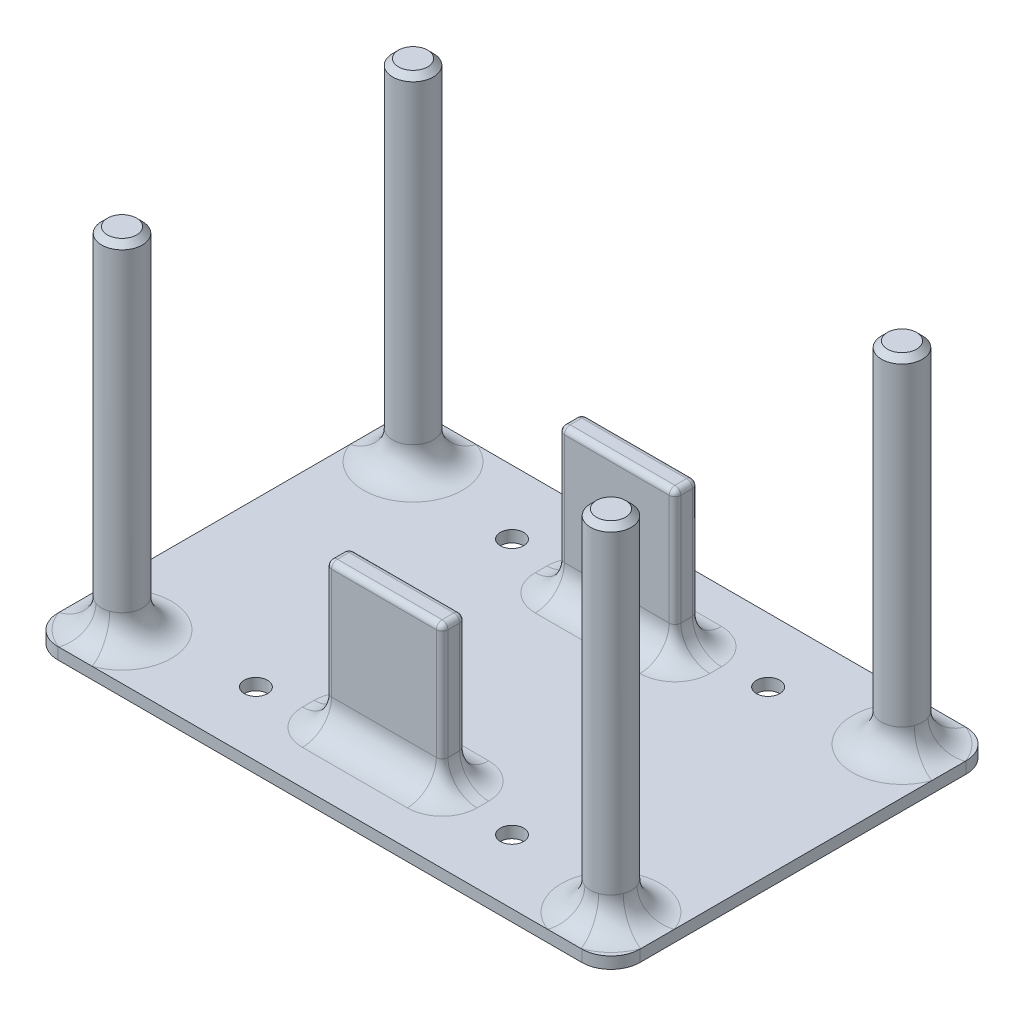
from build123d import *

# Parameters (mm, degrees)
BOSS_EXTRUDE1_DEPTH = 2
SKETCH3_R           = 3.5
BOSS_EXTRUDE2_DEPTH = 60
BOSS_EXTRUDE3_DEPTH = 25
FILLET3_R           = 5
SKETCH6_R           = 2
CUT_EXTRUDE1_DEPTH  = 101.441876541
FILLET4_R           = 5
FILLET5_R           = 1
CHAMFER1_SIZE       = 1


with BuildPart() as part:
    # Sketch1 → Boss-Extrude1 (new body)
    with BuildSketch(Plane(origin=(0, 0, 0), x_dir=(1, 0, 0), z_dir=(0, 1, 0))):
        with BuildLine():
            Line((-35.932773109, 54.768907563), (54.067226891, 54.768907563))
            ThreePointArc((54.067226891, 54.768907563), (57.602760797, 53.304441469), (59.067226891, 49.768907563))
            Line((59.067226891, 49.768907563), (59.067226891, -6.231092437))
            ThreePointArc((59.067226891, -6.231092437), (57.602760797, -9.766626343), (54.067226891, -11.231092437))
            Line((54.067226891, -11.231092437), (-35.932773109, -11.231092437))
            ThreePointArc((-35.932773109, -11.231092437), (-39.468307015, -9.766626343), (-40.932773109, -6.231092437))
            Line((-40.932773109, -6.231092437), (-40.932773109, 49.768907563))
            ThreePointArc((-40.932773109, 49.768907563), (-39.468307015, 53.304441469), (-35.932773109, 54.768907563))
        make_face()
    extrude(amount=BOSS_EXTRUDE1_DEPTH)

    # Sketch3 → Boss-Extrude2 (add)
    with BuildSketch(Plane(origin=(0, 2, 0), x_dir=(1, 0, 0), z_dir=(0, 1, 0))):
        with Locations(Location((-32.932773109, 46.768907563, 0), (0, 0, 270))):
            Circle(SKETCH3_R)
        with Locations(Location((-32.932773109, -3.231092437, 0), (0, 0, 270))):
            Circle(SKETCH3_R)
        with Locations(Location((51.067226891, -3.231092437, 0), (0, 0, 90))):
            Circle(SKETCH3_R)
        with Locations(Location((51.067226891, 46.768907563, 0), (0, 0, 270))):
            Circle(SKETCH3_R)
    extrude(amount=BOSS_EXTRUDE2_DEPTH)

    # Sketch4 → Boss-Extrude3 (add)
    with BuildSketch(Plane(origin=(0, 2, 0), x_dir=(1, 0, 0), z_dir=(0, 1, 0))):
        with BuildLine():
            Line((0.067226891, 43.768907563), (18.067226891, 43.768907563))
            ThreePointArc((18.067226891, 43.768907563), (18.774333672, 43.476014344), (19.067226891, 42.768907563))
            Line((19.067226891, 42.768907563), (19.067226891, 40.768907563))
            ThreePointArc((19.067226891, 40.768907563), (18.774333672, 40.061800782), (18.067226891, 39.768907563))
            Line((18.067226891, 39.768907563), (0.067226891, 39.768907563))
            ThreePointArc((0.067226891, 39.768907563), (-0.63987989, 40.061800782), (-0.932773109, 40.768907563))
            Line((-0.932773109, 40.768907563), (-0.932773109, 42.768907563))
            ThreePointArc((-0.932773109, 42.768907563), (-0.63987989, 43.476014344), (0.067226891, 43.768907563))
        make_face()
        with BuildLine():
            Line((19.067226891, 0.768907563), (19.067226891, 2.768907563))
            ThreePointArc((19.067226891, 2.768907563), (18.774333672, 3.476014344), (18.067226891, 3.768907563))
            Line((18.067226891, 3.768907563), (0.067226891, 3.768907563))
            ThreePointArc((0.067226891, 3.768907563), (-0.63987989, 3.476014344), (-0.932773109, 2.768907563))
            Line((-0.932773109, 2.768907563), (-0.932773109, 0.768907563))
            ThreePointArc((-0.932773109, 0.768907563), (-0.63987989, 0.061800782), (0.067226891, -0.231092437))
            Line((0.067226891, -0.231092437), (18.067226891, -0.231092437))
            ThreePointArc((18.067226891, -0.231092437), (18.774333672, 0.061800782), (19.067226891, 0.768907563))
        make_face()
    extrude(amount=BOSS_EXTRUDE3_DEPTH)

    # Fillet3
    fillet3_edges = [part.edges().sort_by_distance(p)[0] for p in [
        (-32.932773109, 2, -50.268907563),
        (-32.932773109, 2, -0.268907563),
        (51.067226891, 2, 6.731092437),
        (51.067226891, 2, -50.268907563),
    ]]
    fillet(fillet3_edges, radius=FILLET3_R)

    # Sketch6 → Cut-Extrude1 (cut, through all)
    with BuildSketch(Plane(origin=(0, 2, 0), x_dir=(1, 0, 0), z_dir=(0, 1, 0))):
        with Locations(Location((-12.932773109, 43.768907563, 0), (0, 0, 270))):
            Circle(SKETCH6_R)
        with Locations(Location((-12.932773109, -0.231092437, 0), (0, 0, 270))):
            Circle(SKETCH6_R)
        with Locations(Location((31.067226891, -0.231092437, 0), (0, 0, 90))):
            Circle(SKETCH6_R)
        with Locations(Location((31.067226891, 43.768907563, 0), (0, 0, 90))):
            Circle(SKETCH6_R)
    extrude(amount=-CUT_EXTRUDE1_DEPTH, mode=Mode.SUBTRACT)

    # Fillet4
    fillet4_edges = [part.edges().sort_by_distance(p)[0] for p in [
        (-0.63987989, 2, -0.061800782),
        (9.067226891, 2, 0.231092437),
        (18.774333672, 2, -0.061800782),
        (19.067226891, 2, -1.768907563),
        (18.774333672, 2, -3.476014344),
        (9.067226891, 2, -3.768907563),
        (-0.63987989, 2, -3.476014344),
        (-0.932773109, 2, -1.768907563),
        (18.774333672, 2, -40.061800782),
        (19.067226891, 2, -41.768907563),
        (18.774333672, 2, -43.476014344),
        (9.067226891, 2, -43.768907563),
        (-0.63987989, 2, -43.476014344),
        (-0.932773109, 2, -41.768907563),
        (-0.63987989, 2, -40.061800782),
        (9.067226891, 2, -39.768907563),
    ]]
    fillet(fillet4_edges, radius=FILLET4_R)

    # Fillet5
    fillet5_edges = [part.edges().sort_by_distance(p)[0] for p in [
        (-0.63987989, 27, -0.061800782),
        (9.067226891, 27, 0.231092437),
        (18.774333672, 27, -0.061800782),
        (19.067226891, 27, -1.768907563),
        (18.774333672, 27, -3.476014344),
        (9.067226891, 27, -3.768907563),
        (-0.63987989, 27, -3.476014344),
        (-0.932773109, 27, -1.768907563),
        (18.774333672, 27, -40.061800782),
        (19.067226891, 27, -41.768907563),
        (18.774333672, 27, -43.476014344),
        (9.067226891, 27, -43.768907563),
        (-0.63987989, 27, -43.476014344),
        (-0.932773109, 27, -41.768907563),
        (-0.63987989, 27, -40.061800782),
        (9.067226891, 27, -39.768907563),
    ]]
    fillet(fillet5_edges, radius=FILLET5_R)

    # Chamfer1
    chamfer1_edges = [part.edges().sort_by_distance(p)[0] for p in [
        (-32.932773109, 62, -50.268907563),
        (-32.932773109, 62, -0.268907563),
        (51.067226891, 62, 6.731092437),
        (51.067226891, 62, -50.268907563),
    ]]
    chamfer(chamfer1_edges, length=CHAMFER1_SIZE)


solid = part.part
